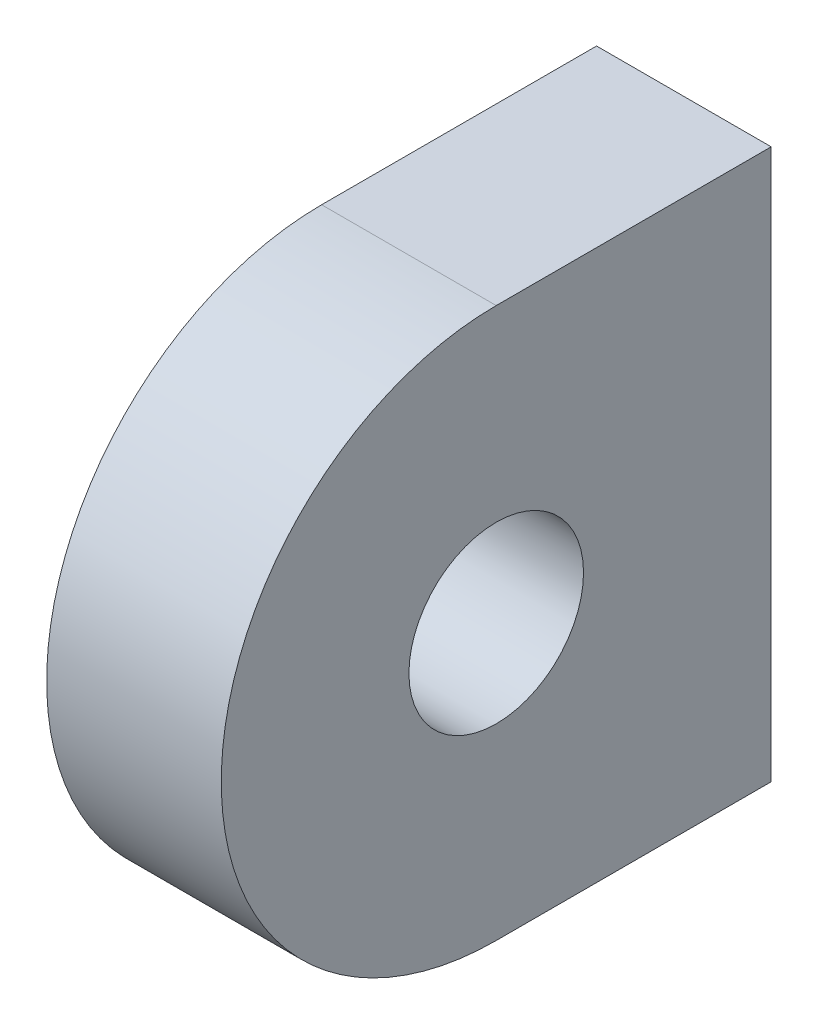
from build123d import *

# Parameters (mm, degrees)
SKETCH1_R           = 3.175
BOSS_EXTRUDE1_DEPTH = 6.35


with BuildPart() as part:
    # Sketch1 → Boss-Extrude1 (new body)
    with BuildSketch(Plane(origin=(0, 0, 0), x_dir=(0, 0, -1), z_dir=(1, 0, 0))):
        with BuildLine():
            Line((0, 10), (10, 10))
            Line((10, 10), (10, -10))
            Line((10, -10), (0, -10))
            ThreePointArc((0, -10), (-10, 0), (0, 10))
        make_face()
        Circle(SKETCH1_R, mode=Mode.SUBTRACT)
    extrude(amount=BOSS_EXTRUDE1_DEPTH)


solid = part.part
